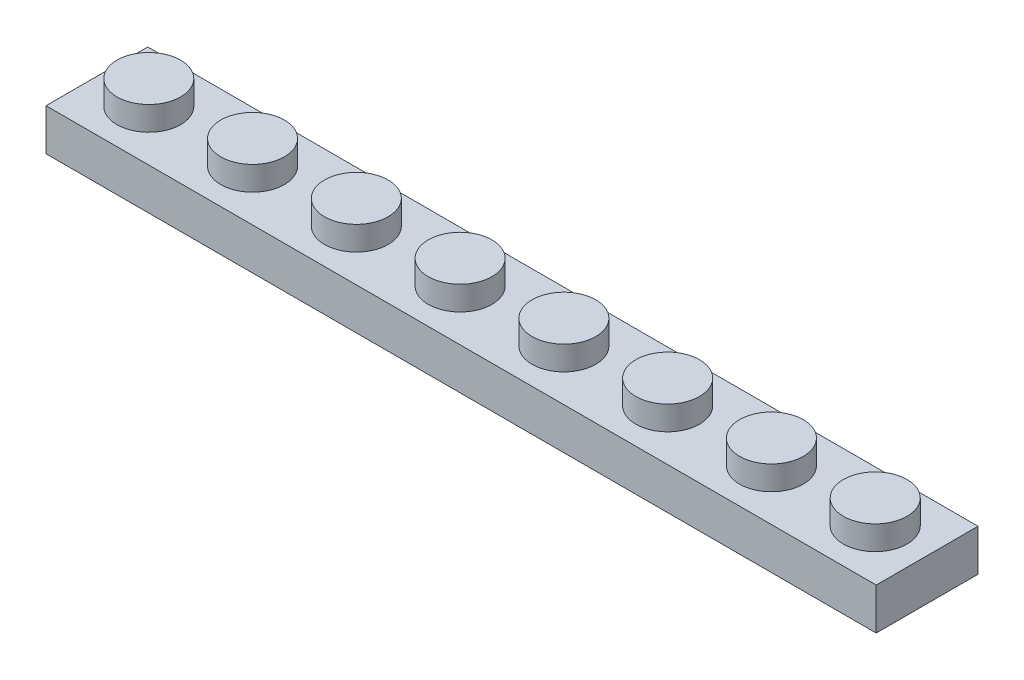
from build123d import *

# Parameters (mm, degrees)
SKETCH1_W           = 63.85
SKETCH1_H           = 7.83
BOSS_EXTRUDE1_DEPTH = 3.2
SKETCH2_R           = 2.45
BOSS_EXTRUDE2_DEPTH = 1.85
SHELL1_T            = -1.6
SKETCH3_R           = 1.5
SKETCH3_R_2         = 0.75
BOSS_EXTRUDE3_DEPTH = 1.4


with BuildPart() as part:
    # Sketch1 → Boss-Extrude1 (new body)
    with BuildSketch(Plane(origin=(0, 0, 0), x_dir=(1, 0, 0), z_dir=(0, 1, 0))):
        Rectangle(SKETCH1_W, SKETCH1_H)
    extrude(amount=-BOSS_EXTRUDE1_DEPTH)

    # Sketch2 → Boss-Extrude2 (add)
    with BuildSketch(Plane(origin=(0, 0, 0), x_dir=(1, 0, 0), z_dir=(0, 1, 0))):
        with Locations(Location((-27.934375, 0, 0), (0, 0, 270))):
            Circle(SKETCH2_R)
        with Locations(Location((-19.953125, 0, 0), (0, 0, 270))):
            Circle(SKETCH2_R)
        with Locations(Location((-11.971875, 0, 0), (0, 0, 270))):
            Circle(SKETCH2_R)
        with Locations(Location((-3.990625, 0, 0), (0, 0, 270))):
            Circle(SKETCH2_R)
        with Locations(Location((3.990625, 0, 0), (0, 0, 270))):
            Circle(SKETCH2_R)
        with Locations(Location((11.971875, 0, 0), (0, 0, 270))):
            Circle(SKETCH2_R)
        with Locations(Location((19.953125, 0, 0), (0, 0, 270))):
            Circle(SKETCH2_R)
        with Locations(Location((27.934375, 0, 0), (0, 0, 270))):
            Circle(SKETCH2_R)
    extrude(amount=BOSS_EXTRUDE2_DEPTH)

    # Shell1
    shell1_openings = [part.faces().sort_by_distance(p)[0] for p in [
        (0, -3.2, 0),
    ]]
    offset(amount=SHELL1_T, openings=shell1_openings, kind=Kind.INTERSECTION)

    # Sketch3 → Boss-Extrude3 (add)
    # profile 1 of 7: a face of its own
    with BuildSketch(Plane.XZ.offset(1.6)):
        with Locations(Location((-23.94375, 0, 0), (0, 0, 90))):
            Circle(SKETCH3_R)
        with Locations(Location((-23.94375, 0, 0), (0, 0, 90))):
            Circle(SKETCH3_R_2, mode=Mode.SUBTRACT)
    # profile 2 of 7: a face of its own
    with BuildSketch(Plane.XZ.offset(1.6)):
        with Locations(Location((-15.9625, 0, 0), (0, 0, 90))):
            Circle(SKETCH3_R)
        with Locations(Location((-15.9625, 0, 0), (0, 0, 90))):
            Circle(SKETCH3_R_2, mode=Mode.SUBTRACT)
    # profile 3 of 7: a face of its own
    with BuildSketch(Plane.XZ.offset(1.6)):
        with Locations(Location((-7.98125, 0, 0), (0, 0, 90))):
            Circle(SKETCH3_R)
        with Locations(Location((-7.98125, 0, 0), (0, 0, 90))):
            Circle(SKETCH3_R_2, mode=Mode.SUBTRACT)
    # profile 4 of 7: a face of its own
    with BuildSketch(Plane.XZ.offset(1.6)):
        with Locations(Location((0, 0, 0), (0, 0, 90))):
            Circle(SKETCH3_R)
        with Locations(Location((0, 0, 0), (0, 0, 90))):
            Circle(SKETCH3_R_2, mode=Mode.SUBTRACT)
    # profile 5 of 7: a face of its own
    with BuildSketch(Plane.XZ.offset(1.6)):
        with Locations(Location((7.98125, 0, 0), (0, 0, 90))):
            Circle(SKETCH3_R)
        with Locations(Location((7.98125, 0, 0), (0, 0, 90))):
            Circle(SKETCH3_R_2, mode=Mode.SUBTRACT)
    # profile 6 of 7: a face of its own
    with BuildSketch(Plane.XZ.offset(1.6)):
        with Locations(Location((15.9625, 0, 0), (0, 0, 90))):
            Circle(SKETCH3_R)
        with Locations(Location((15.9625, 0, 0), (0, 0, 90))):
            Circle(SKETCH3_R_2, mode=Mode.SUBTRACT)
    # profile 7 of 7: a face of its own
    with BuildSketch(Plane.XZ.offset(1.6)):
        with Locations(Location((23.94375, 0, 0), (0, 0, 90))):
            Circle(SKETCH3_R)
        with Locations(Location((23.94375, 0, 0), (0, 0, 90))):
            Circle(SKETCH3_R_2, mode=Mode.SUBTRACT)
    extrude(amount=BOSS_EXTRUDE3_DEPTH)


solid = part.part
